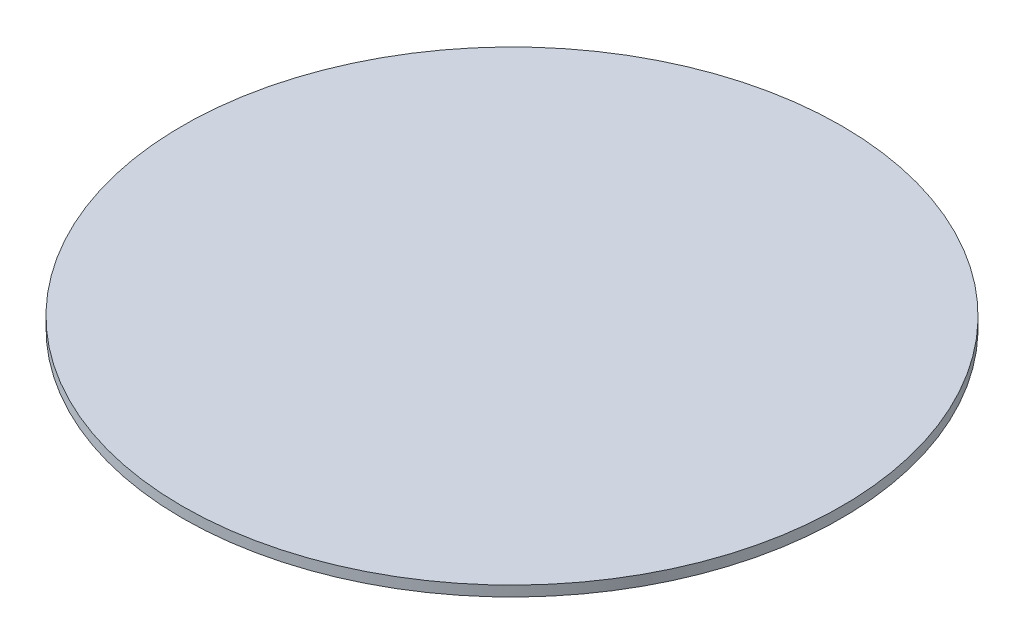
from build123d import *

# Parameters (mm, degrees)
ESBO_O1_R                = 47.8
RESSALTO_EXTRUS_O1_DEPTH = 1.5


with BuildPart() as part:
    # Esboço1 → Ressalto-extrusão1 (new body)
    with BuildSketch(Plane(origin=(0, 0, 0), x_dir=(1, 0, 0), z_dir=(0, 1, 0))):
        with Locations(Location((0, 0, 0), (0, 0, 270))):
            Circle(ESBO_O1_R)
    extrude(amount=RESSALTO_EXTRUS_O1_DEPTH)


solid = part.part
